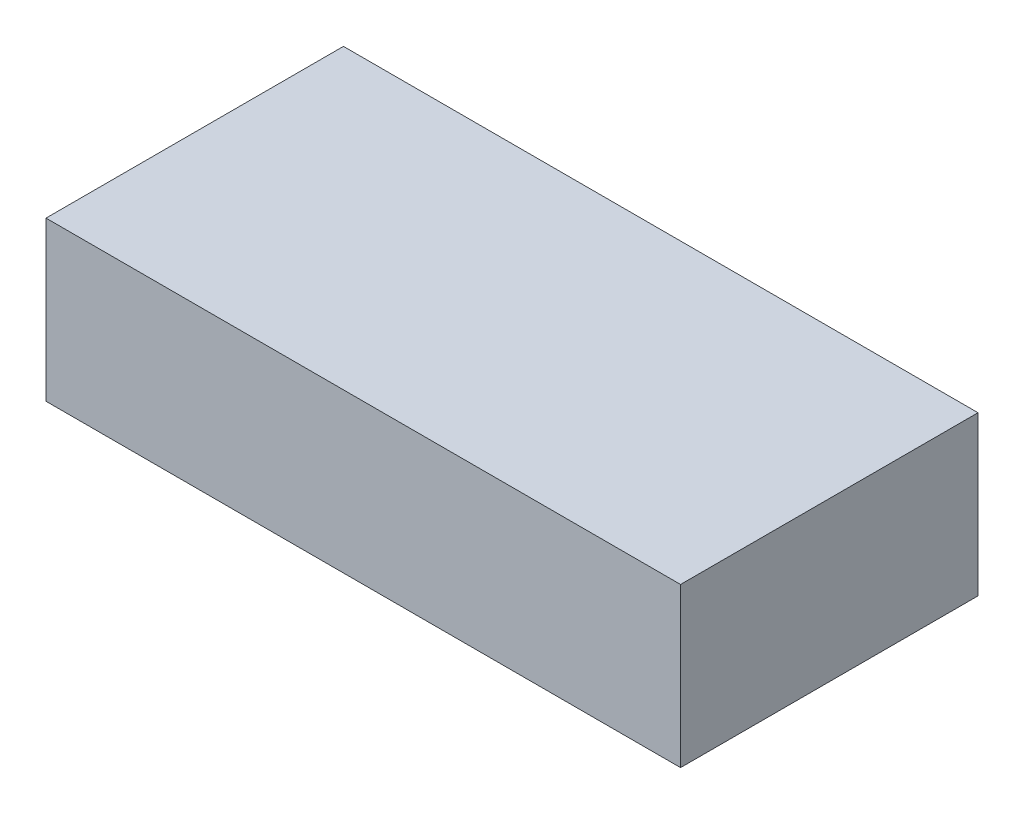
from build123d import *

# Parameters (mm, degrees)
SKETCH1_W           = 32
SKETCH1_H           = 15
BOSS_EXTRUDE1_DEPTH = 4


with BuildPart() as part:
    # Sketch1 → Boss-Extrude1 (new, symmetric)
    with BuildSketch(Plane(origin=(0, 0, 0), x_dir=(1, 0, 0), z_dir=(0, 1, 0))):
        Rectangle(SKETCH1_W, SKETCH1_H)
    extrude(amount=BOSS_EXTRUDE1_DEPTH, both=True)


solid = part.part
